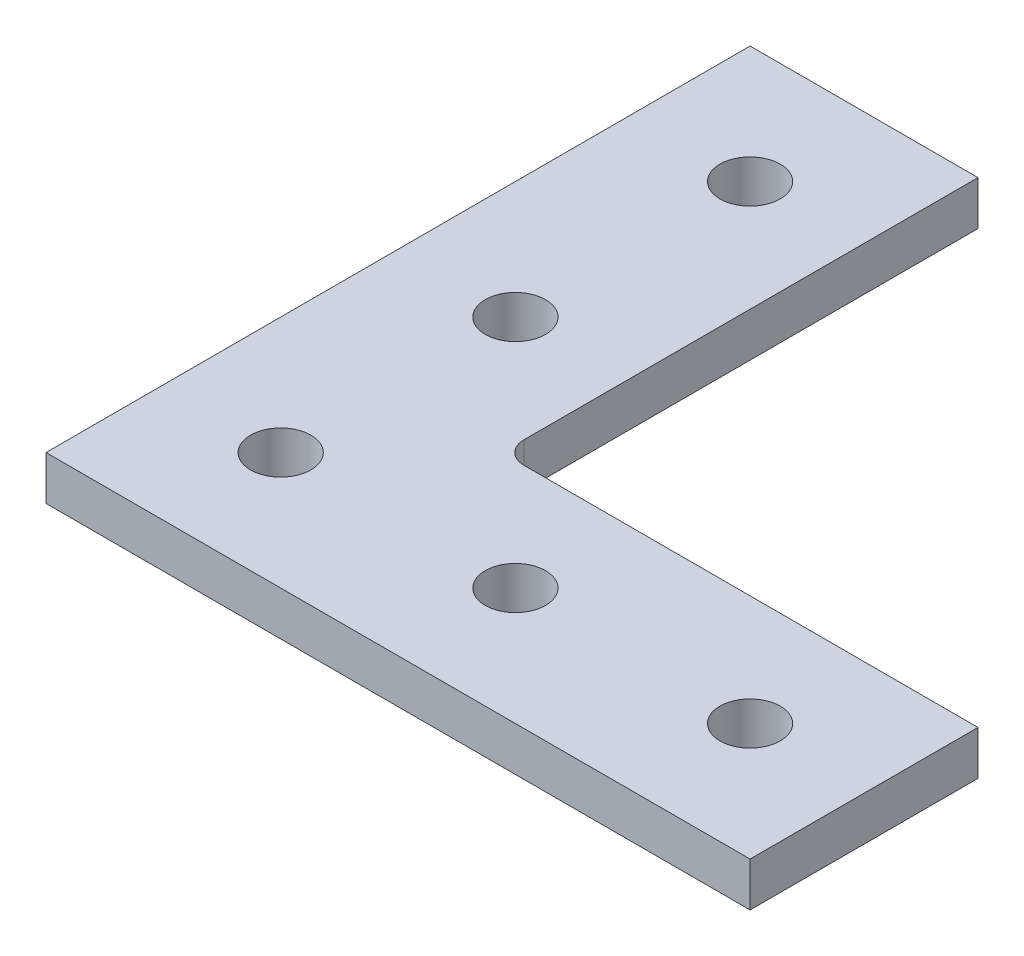
from build123d import *

# Parameters (mm, degrees)
SKETCH1_R      = 3.2639
EXTRUDE1_DEPTH = 4.7752


with BuildPart() as part:
    # Sketch1 → Extrude1 (new body)
    with BuildSketch(Plane(origin=(0, 0, 0), x_dir=(1, 0, 0), z_dir=(0, 1, 0))):
        with BuildLine():
            Line((24.666993976, 76.2), (24.666993976, 27.048243976))
            ThreePointArc((24.666993976, 27.048243976), (25.364445953, 25.364445953), (27.048243976, 24.666993976))
            Line((27.048243976, 24.666993976), (76.2, 24.666993976))
            Line((76.2, 24.666993976), (76.2, 0))
            Line((76.2, 0), (0, 0))
            Line((0, 0), (0, 76.2))
            Line((0, 76.2), (24.666993976, 76.2))
        make_face()
        with Locations(Location((12.7, 63.5, 0), (0, 0, 270))):
            Circle(SKETCH1_R, mode=Mode.SUBTRACT)
        with Locations(Location((12.7, 38.1, 0), (0, 0, 270))):
            Circle(SKETCH1_R, mode=Mode.SUBTRACT)
        with Locations(Location((12.7, 12.7, 0), (0, 0, 270))):
            Circle(SKETCH1_R, mode=Mode.SUBTRACT)
        with Locations(Location((38.1, 12.7, 0), (0, 0, 270))):
            Circle(SKETCH1_R, mode=Mode.SUBTRACT)
        with Locations(Location((63.5, 12.7, 0), (0, 0, 270))):
            Circle(SKETCH1_R, mode=Mode.SUBTRACT)
    extrude(amount=EXTRUDE1_DEPTH)


solid = part.part
